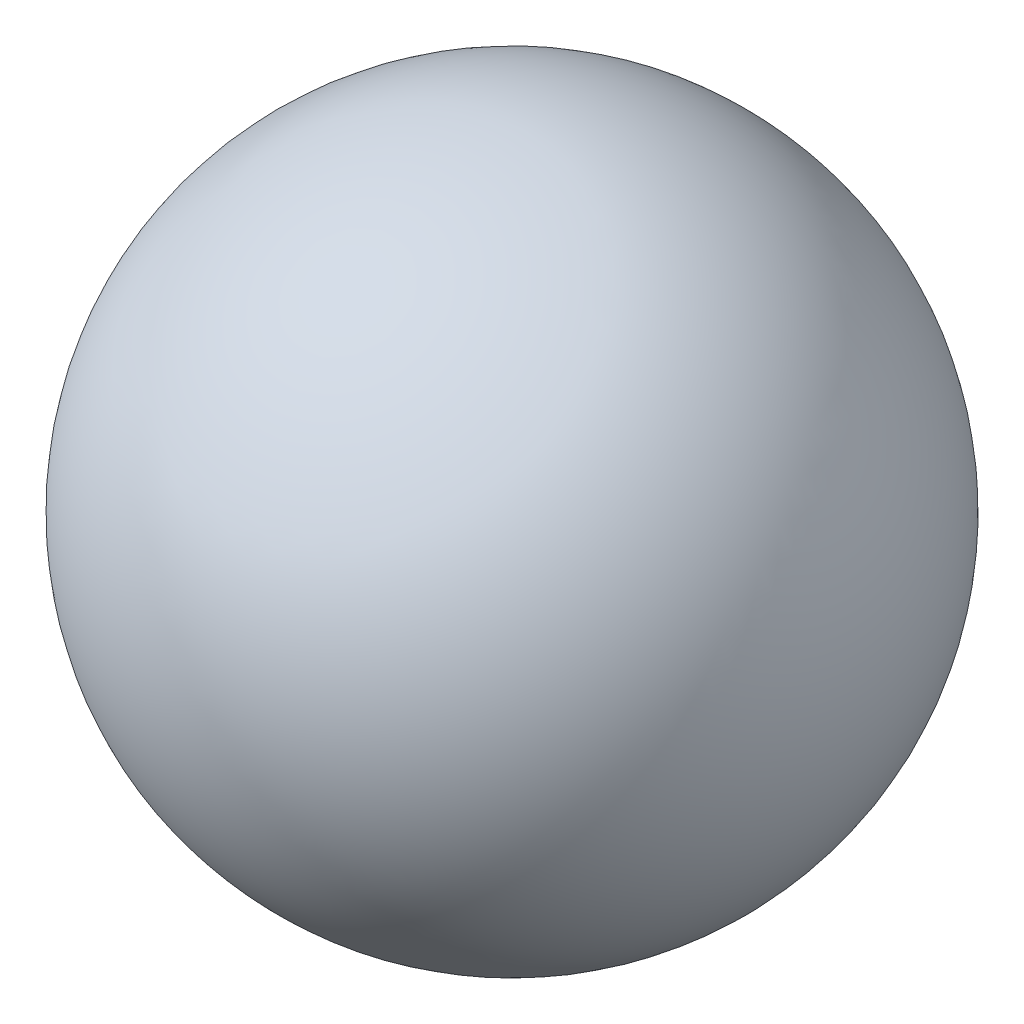
from build123d import *


with BuildPart() as part:
    # Sketch1 → Revolve1 (revolve)
    with BuildSketch(Plane.XY):
        with BuildLine():
            Line((-1.604994878, -2.779932675), (-2.363755122, -4.094143968))
            ThreePointArc((-2.363755122, -4.094143968), (-1.327269354, -3.816418443), (-1.604994878, -2.779932675))
        make_face()
    revolve(axis=Axis((-1.510149848, -2.615656263, 0), (-0.5000000000000067, -0.8660254037844348, 0)))


solid = part.part
